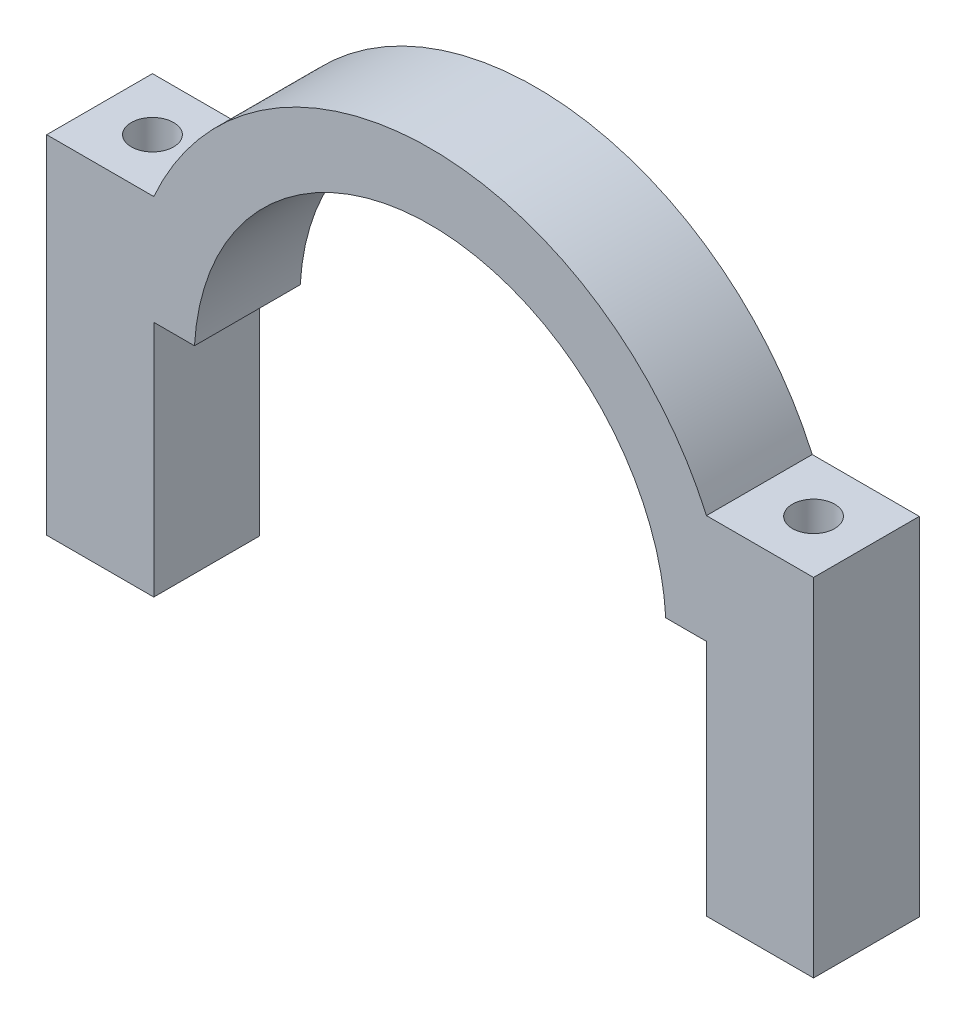
from build123d import *

# Parameters (mm, degrees)
EXTRUDE_1_DEPTH          = 8
CUT_EXTRUDE_1_DEPTH      = 50.930176246
CUT_EXTRUDE_1_DEPTH_BACK = 50.930176246
SKETCH_2_R               = 1.6


with BuildPart() as part:
    # ｽｹｯﾁ1 → ﾎﾞｽ - 押し出し1 (new body)
    with BuildSketch(Plane.XY):
        with BuildLine():
            Line((-20.9, 9.236476601), (-29, 9.236476601))
            Line((-29, 9.236476601), (-29, -17))
            Line((-29, -17), (-20.9, -17))
            Line((-20.9, -17), (-20.9, 1))
            Line((-20.9, 1), (-17.821966783, 1))
            ThreePointArc((-17.821966783, 1), (0, 17.85), (17.821966783, 1))
            Line((17.821966783, 1), (20.9, 1))
            Line((20.9, 1), (20.9, -17))
            Line((20.9, -17), (29, -17))
            Line((29, -17), (29, 9.236476601))
            Line((29, 9.236476601), (20.9, 9.236476601))
            ThreePointArc((20.9, 9.236476601), (0, 22.85), (-20.9, 9.236476601))
        make_face()
    extrude(amount=EXTRUDE_1_DEPTH)

    # ｽｹｯﾁ2 → ｶｯﾄ - 押し出し1 (cut, two sides: drawn at the far end of the back side and taken through both)
    with BuildSketch(Plane.XZ.offset(17).offset(-CUT_EXTRUDE_1_DEPTH_BACK)):
        with Locations((-25, 4)):
            Circle(SKETCH_2_R)
        with Locations((25, 4)):
            Circle(SKETCH_2_R)
    extrude(amount=CUT_EXTRUDE_1_DEPTH + CUT_EXTRUDE_1_DEPTH_BACK, mode=Mode.SUBTRACT)


solid = part.part
